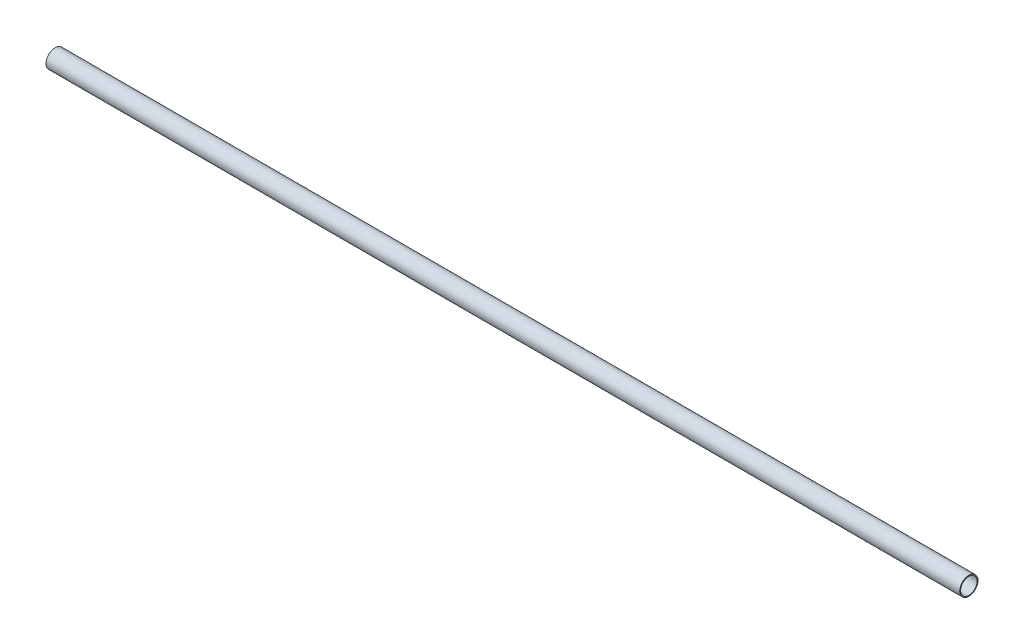
from build123d import *

# Parameters (mm, degrees)
SKETCH1_R           = 10
SKETCH1_R_2         = 9
BOSS_EXTRUDE1_DEPTH = 500


with BuildPart() as part:
    # Sketch1 → Boss-Extrude1 (new, symmetric)
    with BuildSketch(Plane(origin=(0, 0, 0), x_dir=(0, 0, -1), z_dir=(1, 0, 0))):
        Circle(SKETCH1_R)
        Circle(SKETCH1_R_2, mode=Mode.SUBTRACT)
    extrude(amount=BOSS_EXTRUDE1_DEPTH, both=True)


solid = part.part
